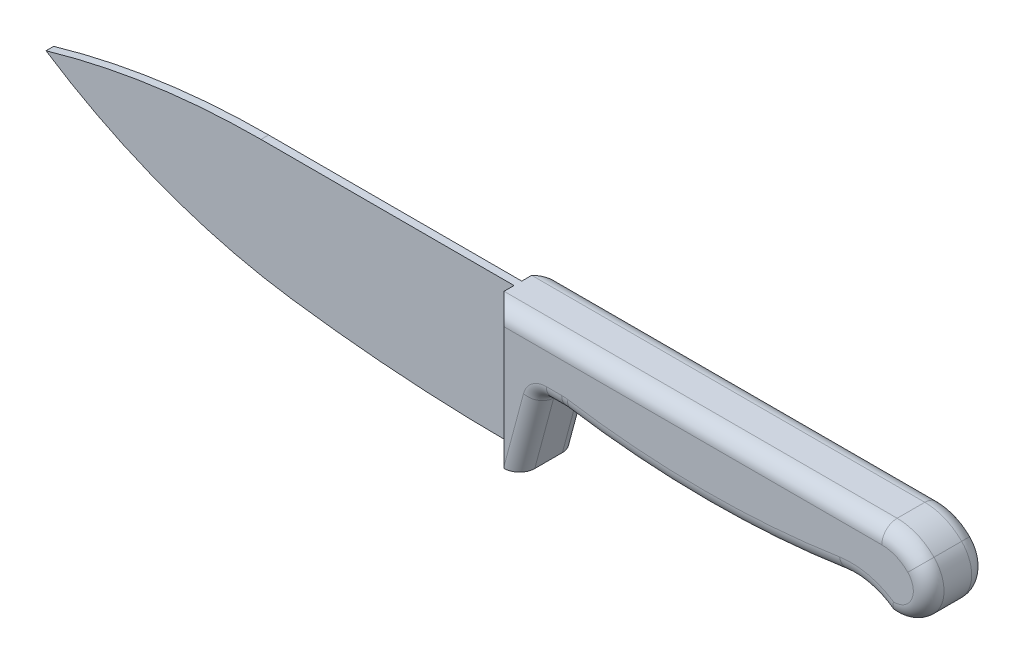
from build123d import *

# Parameters (mm, degrees)
BOSS_EXTRUDE1_DEPTH = 1.25
BOSS_EXTRUDE2_DEPTH = 9.5
CHAMFER1_SIZE       = 5
FILLET1_R           = 5


with BuildPart() as part:
    # Sketch1 → Boss-Extrude1 (new, symmetric)
    with BuildSketch(Plane.XY):
        with BuildLine():
            Line((0, 0), (0, -45))
            ThreePointArc((0, -45), (-36.286223281, -43.748513109), (-72.4, -40))
            ThreePointArc((-72.4, -40), (-114.06327772, -29.435407254), (-152.4, -10))
            ThreePointArc((-152.4, -10), (-117.755339059, -2.512626585), (-82.4, 0))
            Line((-82.4, 0), (0, 0))
        make_face()
    extrude(amount=BOSS_EXTRUDE1_DEPTH, both=True)

    # Sketch2 → Boss-Extrude2 (add, symmetric)
    with BuildSketch(Plane.XY):
        with BuildLine():
            Line((0, 0), (128, 0))
            ThreePointArc((128, 0), (134.5, -1.3), (140, -5))
            ThreePointArc((140, -5), (141.968086361, -18.167413874), (130, -24))
            ThreePointArc((130, -24), (122.876979683, -20.60373569), (114.994710808, -20.227083248))
            ThreePointArc((114.994710808, -20.227083248), (69.989649226, -23.594360459), (24.994710808, -20.094411808))
            ThreePointArc((24.994710808, -20.094411808), (24.383812263, -20.023637874), (23.769282172, -20))
            Line((23.769282172, -20), (18.769282172, -20))
            ThreePointArc((18.769282172, -20), (17.12660254, -20.557614597), (16.162831426, -22))
            Line((16.162831426, -22), (10, -45))
            Line((10, -45), (0, -45))
            Line((0, -45), (0, 0))
        make_face()
    extrude(amount=BOSS_EXTRUDE2_DEPTH, both=True)

    # Chamfer1
    chamfer1_edges = [part.edges().sort_by_distance(p)[0] for p in [
        (0, -22.5, -9.5),
        (0, -22.5, 9.5),
    ]]
    chamfer(chamfer1_edges, length=CHAMFER1_SIZE)

    # Fillet1
    fillet1_edges = [part.edges().sort_by_distance(p)[0] for p in [
        (13.081415713, -33.5, -9.5),
        (17.12660254, -20.557614597, -9.5),
        (21.269282172, -20, -9.5),
        (24.383812263, -20.023637874, -9.5),
        (122.876979683, -20.60373569, -9.5),
        (141.968086361, -18.167413874, -9.5),
        (134.5, -1.3, -9.5),
        (13.081415713, -33.5, 9.5),
        (17.12660254, -20.557614597, 9.5),
        (21.269282172, -20, 9.5),
        (24.383812263, -20.023637874, 9.5),
        (122.876979683, -20.60373569, 9.5),
        (141.968086361, -18.167413874, 9.5),
        (134.5, -1.3, 9.5),
        (69.989649226, -23.594360459, -9.5),
        (66.5, 0, -9.5),
        (69.989649226, -23.594360459, 9.5),
        (66.5, 0, 9.5),
    ]]
    fillet(fillet1_edges, radius=FILLET1_R)


solid = part.part
